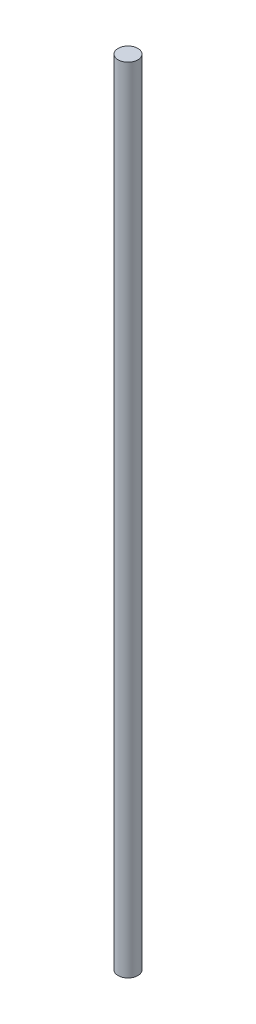
from build123d import *

# Parameters (mm, degrees)
SKETCH2_R           = 10
BOSS_EXTRUDE1_DEPTH = 800


with BuildPart() as part:
    # Sketch2 → Boss-Extrude1 (new body)
    with BuildSketch(Plane(origin=(0, 0, 0), x_dir=(1, 0, 0), z_dir=(0, 1, 0))):
        Circle(SKETCH2_R)
    extrude(amount=BOSS_EXTRUDE1_DEPTH)


solid = part.part
